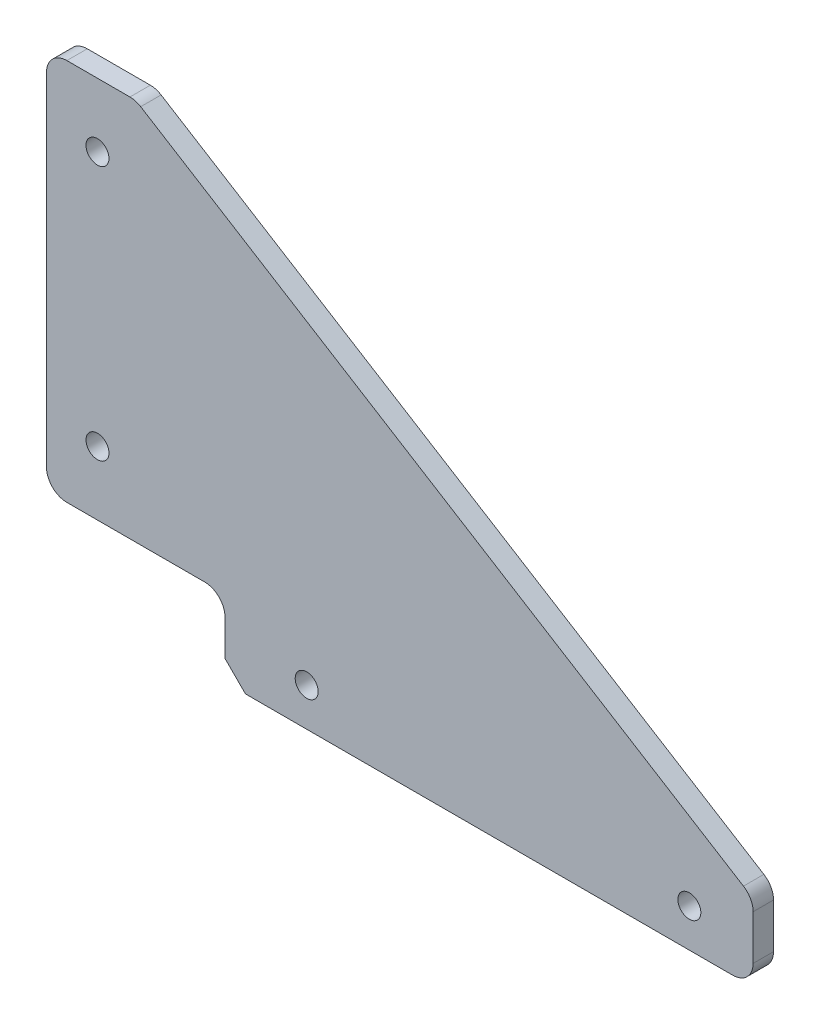
from build123d import *

# Parameters (mm, degrees)
SKETCH1_R           = 4.5
BOSS_EXTRUDE1_DEPTH = 8


with BuildPart() as part:
    # Sketch1 → Boss-Extrude1 (new body)
    with BuildSketch(Plane.XY):
        with BuildLine():
            Line((-119.390660592, 123.251708428), (-119.390660592, -10.748291572))
            ThreePointArc((-119.390660592, -10.748291572), (-117.047514842, -16.405145821), (-111.390660592, -18.748291572))
            Line((-111.390660592, -18.748291572), (-57.390660592, -18.748291572))
            ThreePointArc((-57.390660592, -18.748291572), (-51.733806343, -21.091437322), (-49.390660592, -26.748291572))
            Line((-49.390660592, -26.748291572), (-49.390660592, -40.748291572))
            Line((-49.390660592, -40.748291572), (-41.390660592, -48.748291572))
            Line((-41.390660592, -48.748291572), (149.609339408, -48.748291572))
            ThreePointArc((149.609339408, -48.748291572), (155.266193657, -46.405145821), (157.609339408, -40.748291572))
            Line((157.609339408, -40.748291572), (157.609339408, -23.201759464))
            ThreePointArc((157.609339408, -23.201759464), (156.599247983, -19.310592788), (153.824044881, -16.402034634))
            Line((153.824044881, -16.402034634), (-82.454216652, 130.051433259))
            ThreePointArc((-82.454216652, 130.051433259), (-84.477780716, 130.945790526), (-86.668922126, 131.251708428))
            Line((-86.668922126, 131.251708428), (-111.390660592, 131.251708428))
            ThreePointArc((-111.390660592, 131.251708428), (-117.047514842, 128.908562678), (-119.390660592, 123.251708428))
        make_face()
        with Locations((-99.390660592, 106.251708428)):
            Circle(SKETCH1_R, mode=Mode.SUBTRACT)
        with Locations((-99.390660592, 6.251708428)):
            Circle(SKETCH1_R, mode=Mode.SUBTRACT)
        with Locations((-17.390660592, -33.748291572)):
            Circle(SKETCH1_R, mode=Mode.SUBTRACT)
        with Locations((132.609339408, -33.748291572)):
            Circle(SKETCH1_R, mode=Mode.SUBTRACT)
    extrude(amount=BOSS_EXTRUDE1_DEPTH)


solid = part.part
